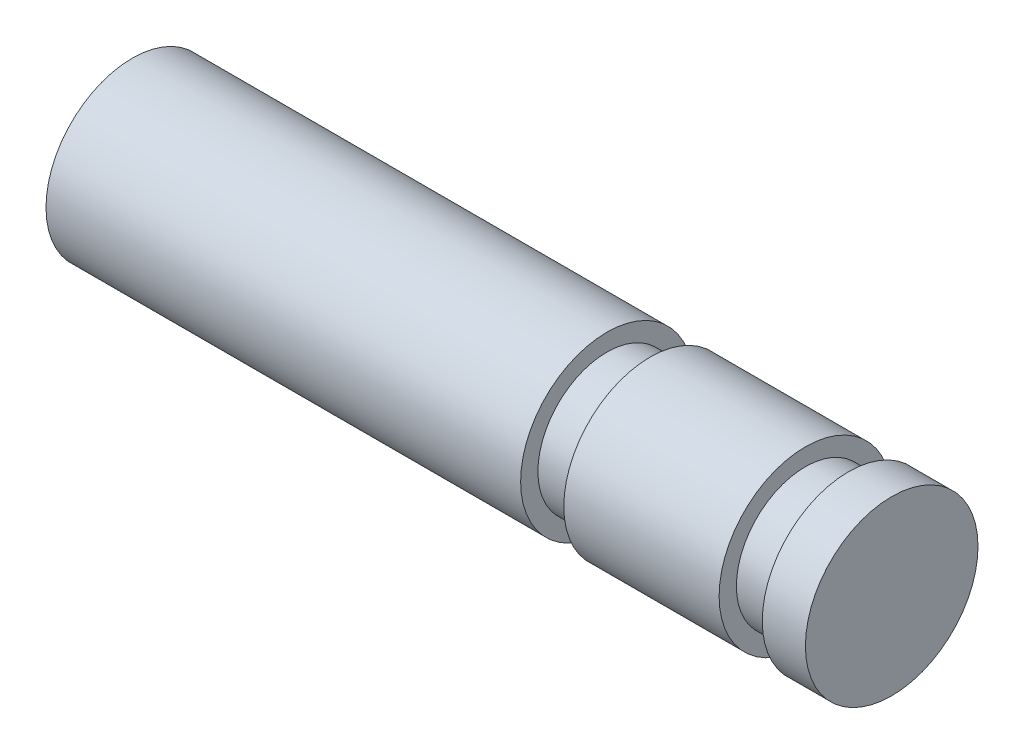
from build123d import *


with BuildPart() as part:
    # Sketch1 → Revolve1 (revolve)
    with BuildSketch(Plane.XY, mode=Mode.PRIVATE) as revolve1_sk:
        Polygon((-31.2, 0), (-31.2, 4), (-9.2, 4), (-9.2, 3.2), (-7.2, 3.2), (-7.2, 4), (0, 4), (0, 3.2), (2, 3.2), (2, 4), (4, 4), (4, 0), align=None)
    revolve(revolve1_sk.sketch.rotate(Axis((-31.2, 0, 0), (1, 0, 0)), 90), axis=Axis((-31.2, 0, 0), (1, 0, 0)))


solid = part.part
